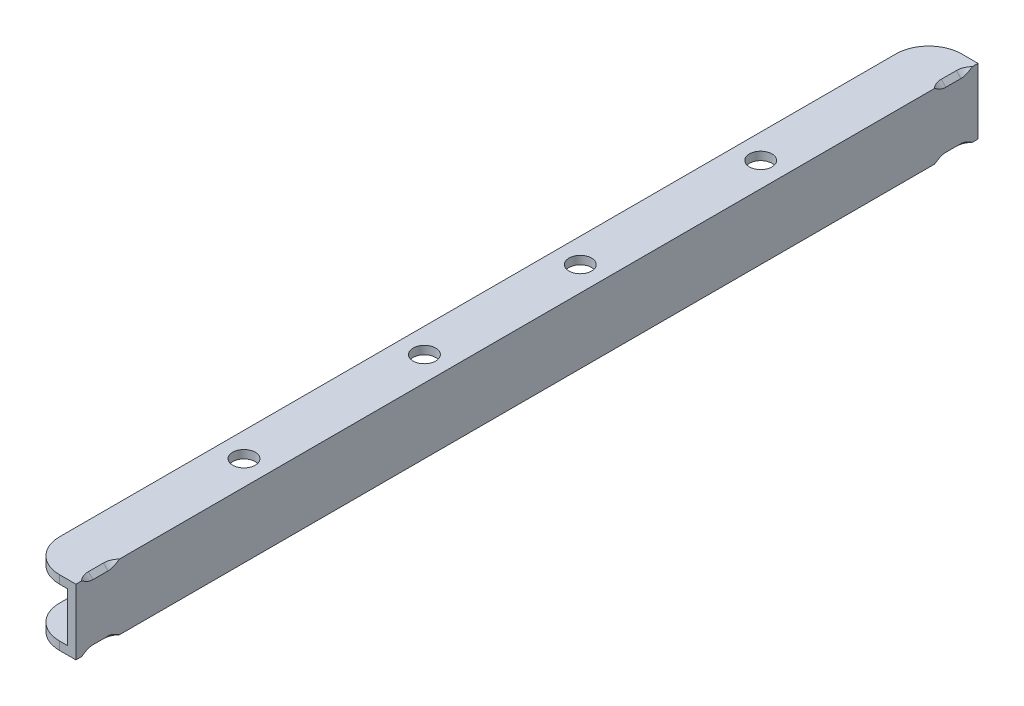
from build123d import *

# Parameters (mm, degrees)
BOSS_EXTRUDE1_DEPTH = 174.625
CUT_EXTRUDE1_REACH  = 179.488
SKETCH3_R           = 2.3495
CUT_EXTRUDE2_REACH  = 179.488
SKETCH4_R           = 4.3688
FILLET1_R           = 12.7


with BuildPart() as part:
    # Sketch1 → Boss-Extrude1 (new, symmetric)
    with BuildSketch(Plane.XY):
        Polygon((-19.05, 0), (0, 0), (0, 25.4), (-19.05, 25.4), (-19.05, 22.225), (-3.175, 22.225), (-3.175, 3.175), (-19.05, 3.175), align=None)
    extrude(amount=BOSS_EXTRUDE1_DEPTH, both=True)

    # Sketch3 → Cut-Extrude1 (cut, up to next)
    with BuildSketch(Plane.XZ, mode=Mode.PRIVATE) as cut_extrude1_sk1:
        with Locations(Location((-9.525, -30.1752, 0), (0, 0, 270))):
            Circle(SKETCH3_R)
    cut_extrude1_tool1 = extrude(cut_extrude1_sk1.sketch, amount=-CUT_EXTRUDE1_REACH, mode=Mode.PRIVATE) & part.part
    # Sketch3 → Cut-Extrude1 (cut, up to next)
    with BuildSketch(Plane.XZ, mode=Mode.PRIVATE) as cut_extrude1_sk2:
        with Locations(Location((-9.525, -100.0252, 0), (0, 0, 270))):
            Circle(SKETCH3_R)
    cut_extrude1_tool2 = extrude(cut_extrude1_sk2.sketch, amount=-CUT_EXTRUDE1_REACH, mode=Mode.PRIVATE) & part.part
    # Sketch3 → Cut-Extrude1 (cut, up to next)
    with BuildSketch(Plane.XZ, mode=Mode.PRIVATE) as cut_extrude1_sk3:
        with Locations(Location((-9.525, 30.1752, 0), (0, 0, 270))):
            Circle(SKETCH3_R)
    cut_extrude1_tool3 = extrude(cut_extrude1_sk3.sketch, amount=-CUT_EXTRUDE1_REACH, mode=Mode.PRIVATE) & part.part
    # Sketch3 → Cut-Extrude1 (cut, up to next)
    with BuildSketch(Plane.XZ, mode=Mode.PRIVATE) as cut_extrude1_sk4:
        with Locations(Location((-9.525, 100.0252, 0), (0, 0, 270))):
            Circle(SKETCH3_R)
    cut_extrude1_tool4 = extrude(cut_extrude1_sk4.sketch, amount=-CUT_EXTRUDE1_REACH, mode=Mode.PRIVATE) & part.part
    add(cut_extrude1_tool1.solids().sort_by_distance((-9.525, 0, -30.1752))[0], mode=Mode.SUBTRACT)
    add(cut_extrude1_tool2.solids().sort_by_distance((-9.525, 0, -100.0252))[0], mode=Mode.SUBTRACT)
    add(cut_extrude1_tool3.solids().sort_by_distance((-9.525, 0, 30.1752))[0], mode=Mode.SUBTRACT)
    add(cut_extrude1_tool4.solids().sort_by_distance((-9.525, 0, 100.0252))[0], mode=Mode.SUBTRACT)

    # Sketch4 → Cut-Extrude2 (cut, up to next)
    with BuildSketch(Plane(origin=(0, 25.4, 0), x_dir=(1, 0, 0), z_dir=(0, 1, 0)), mode=Mode.PRIVATE) as cut_extrude2_sk1:
        with Locations(Location((-9.525, -100.0252, 0), (0, 0, 180))):
            Circle(SKETCH4_R)
    cut_extrude2_tool1 = extrude(cut_extrude2_sk1.sketch, amount=-CUT_EXTRUDE2_REACH, mode=Mode.PRIVATE) & part.part
    # Sketch4 → Cut-Extrude2 (cut, up to next)
    with BuildSketch(Plane(origin=(0, 25.4, 0), x_dir=(1, 0, 0), z_dir=(0, 1, 0)), mode=Mode.PRIVATE) as cut_extrude2_sk2:
        with Locations(Location((-9.525, -30.1752, 0), (0, 0, 180))):
            Circle(SKETCH4_R)
    cut_extrude2_tool2 = extrude(cut_extrude2_sk2.sketch, amount=-CUT_EXTRUDE2_REACH, mode=Mode.PRIVATE) & part.part
    # Sketch4 → Cut-Extrude2 (cut, up to next)
    with BuildSketch(Plane(origin=(0, 25.4, 0), x_dir=(1, 0, 0), z_dir=(0, 1, 0)), mode=Mode.PRIVATE) as cut_extrude2_sk3:
        with Locations(Location((-9.525, 30.1752, 0), (0, 0, 180))):
            Circle(SKETCH4_R)
    cut_extrude2_tool3 = extrude(cut_extrude2_sk3.sketch, amount=-CUT_EXTRUDE2_REACH, mode=Mode.PRIVATE) & part.part
    # Sketch4 → Cut-Extrude2 (cut, up to next)
    with BuildSketch(Plane(origin=(0, 25.4, 0), x_dir=(1, 0, 0), z_dir=(0, 1, 0)), mode=Mode.PRIVATE) as cut_extrude2_sk4:
        with Locations(Location((-9.525, 100.0252, 0), (0, 0, 180))):
            Circle(SKETCH4_R)
    cut_extrude2_tool4 = extrude(cut_extrude2_sk4.sketch, amount=-CUT_EXTRUDE2_REACH, mode=Mode.PRIVATE) & part.part
    add(cut_extrude2_tool1.solids().sort_by_distance((-9.525, 25.4, 100.0252))[0], mode=Mode.SUBTRACT)
    add(cut_extrude2_tool2.solids().sort_by_distance((-9.525, 25.4, 30.1752))[0], mode=Mode.SUBTRACT)
    add(cut_extrude2_tool3.solids().sort_by_distance((-9.525, 25.4, -30.1752))[0], mode=Mode.SUBTRACT)
    add(cut_extrude2_tool4.solids().sort_by_distance((-9.525, 25.4, -100.0252))[0], mode=Mode.SUBTRACT)

    # Fillet1
    fillet1_edges = [part.edges().sort_by_distance(p)[0] for p in [
        (-19.05, 1.5875, -174.625),
        (-19.05, 23.8125, 174.625),
        (-19.05, 1.5875, 174.625),
        (-19.05, 23.8125, -174.625),
    ]]
    fillet(fillet1_edges, radius=FILLET1_R)

    # Cut-Sweep1: sweep along a path in Sketch5
    with BuildLine(Plane(origin=(0, 25.4, 0), x_dir=(1, 0, 0), z_dir=(0, 1, 0))) as cut_sweep1_path:
        Line((7.112, -155.829), (4.572, -155.829))
        ThreePointArc((4.572, -155.829), (0.081871939, -157.688871939), (-1.778, -162.179))
        Line((-1.778, -162.179), (-1.778, -168.021))
        ThreePointArc((-1.778, -168.021), (0.081871939, -172.511128061), (4.572, -174.371))
        Line((4.572, -174.371), (7.112, -174.371))
    # Sketch6 → Cut-Sweep1 (sweep, cut)
    with BuildSketch(Plane(origin=(7.112, 25.4, 174.371), x_dir=(0, 0, -1), z_dir=(1, 0, 0))):
        Polygon((-0.508, 0.508), (4.572, -4.572), (4.572, 0.508), align=None)
        Polygon((4.572, -20.828), (4.572, -25.908), (-0.508, -25.908), align=None)
    cut_sweep1 = sweep(path=cut_sweep1_path.line, mode=Mode.SUBTRACT)

    # Mirror1: Cut-Sweep1 across plane
    add(cut_sweep1.mirror(Plane.XY), mode=Mode.SUBTRACT)


solid = part.part
